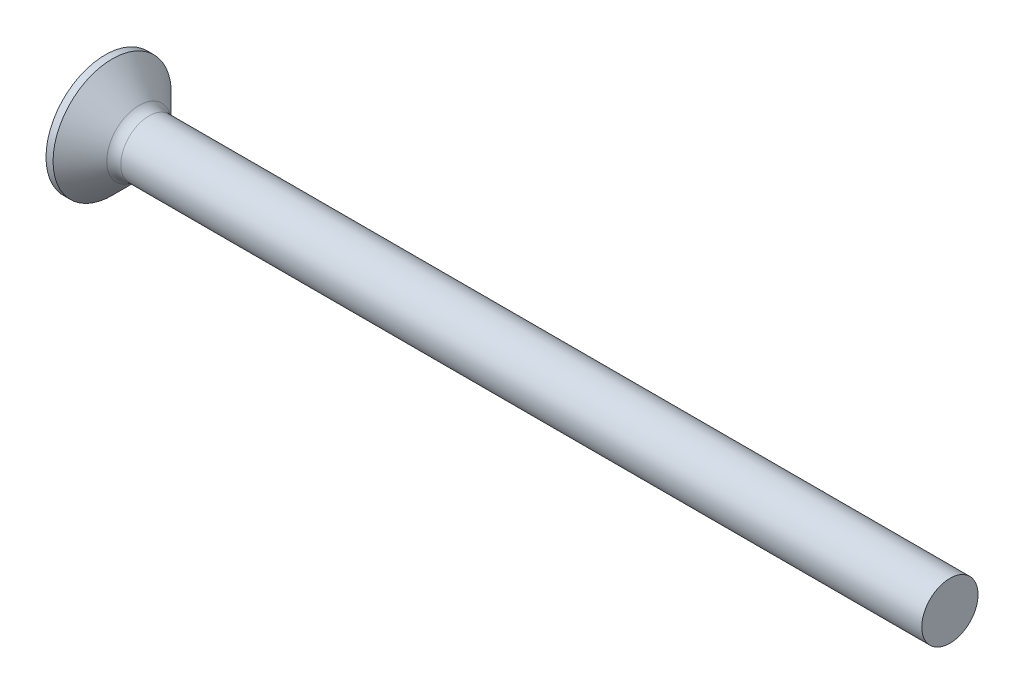
from build123d import *

# Parameters (mm, degrees)
FILLET1_R    = 1
RECPAT_COUNT = 2
RECPAT_ANGLE = 90


with BuildPart() as part:
    # BodySke → Base-Revolve (revolve)
    with BuildSketch(Plane.XY, mode=Mode.PRIVATE) as base_revolve_sk:
        with BuildLine():
            Line((0, 0), (61, 0))
            Line((61, 0), (61, 2))
            Line((61, 2), (3.7, 2))
            Line((3.7, 2), (1.5, 4.2))
            Line((1.5, 4.2), (1, 4.2))
            ThreePointArc((1, 4.2), (0.253446079, 2.158703314), (0, 0))
        make_face()
    revolve(base_revolve_sk.sketch.rotate(Axis((-15.875, 0, 0), (1, 0, 0)), 90), axis=Axis((-15.875, 0, 0), (1, 0, 0)))

    # Fillet1
    fillet1_edges = [part.edges().sort_by_distance(p)[0] for p in [
        (3.7, 0, -2),
    ]]
    fillet(fillet1_edges, radius=FILLET1_R)

    # Sketch3 → Recess section 0
    with BuildSketch(Plane(origin=(0, 0, 0), x_dir=(0, 0, -1), z_dir=(1, 0, 0))):
        with BuildLine():
            Line((0.515, -2.5), (-0.515, -2.5))
            Line((-0.515, -2.5), (-0.515, 2.5))
            Line((-0.515, 2.5), (0.515, 2.5))
            Line((0.515, 2.5), (0.515, -2.5))
        make_face()
    # Sketch4 → Recess section 1
    with BuildSketch(Plane(origin=(3.1, 0, 0), x_dir=(0, 0, -1), z_dir=(1, 0, 0))):
        with BuildLine():
            Line((0.515, -0.954397274), (-0.515, -0.954397274))
            Line((-0.515, -0.954397274), (-0.515, 0.954397274))
            Line((-0.515, 0.954397274), (0.515, 0.954397274))
            Line((0.515, 0.954397274), (0.515, -0.954397274))
        make_face()
    recess = loft(mode=Mode.SUBTRACT)

    # RecPat: Recess ×2 about axis
    recpat_axis = Axis((0, 0, 0), (1, 0, 0))
    for i in range(1, RECPAT_COUNT):
        add(recess.rotate(recpat_axis, i * RECPAT_ANGLE / (RECPAT_COUNT - 1)), mode=Mode.SUBTRACT)

    # RecCorSke → RecessCore (revolve, cut)
    with BuildSketch(Plane.XY, mode=Mode.PRIVATE) as recesscore_sk:
        Polygon((0, 0), (0, 1.067773117), (3.1, 0.851), (3.376506661, 0), align=None)
    revolve(recesscore_sk.sketch.rotate(Axis((-3.175, 0, 0), (1, 0, 0)), 90), axis=Axis((-3.175, 0, 0), (1, 0, 0)), mode=Mode.SUBTRACT)


solid = part.part
